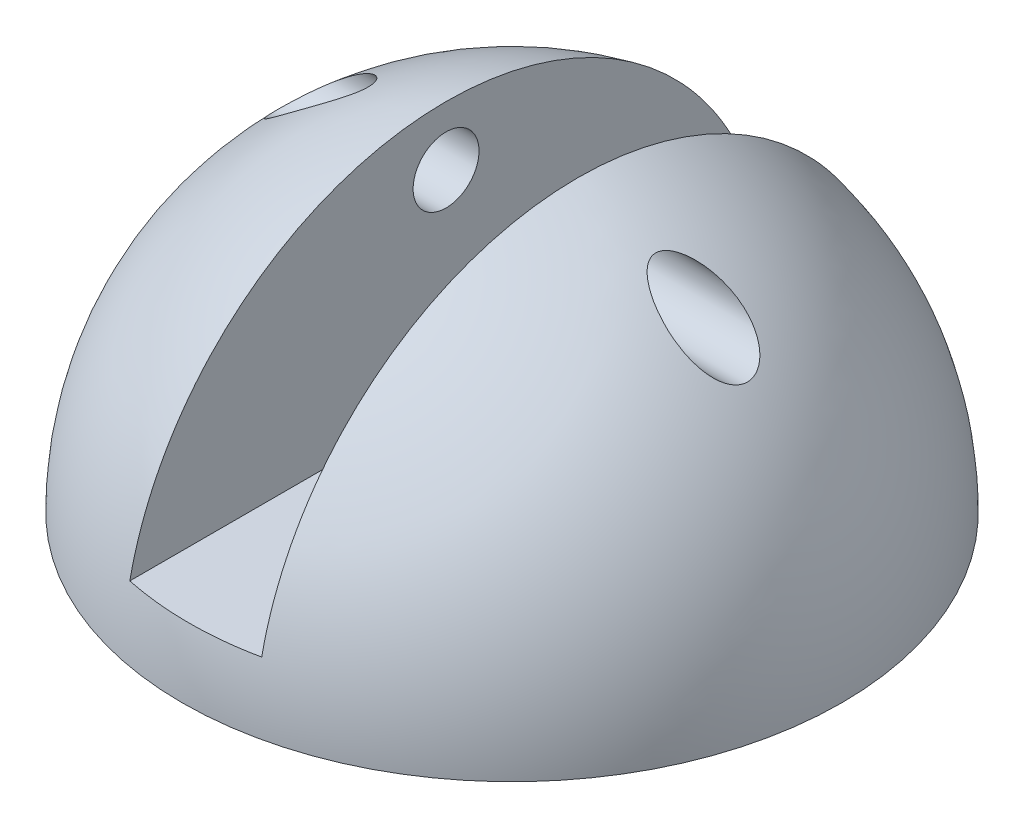
from build123d import *

# Parameters (mm, degrees)
REVOLVE1_ANGLE          = 180
SKETCH2_W               = 10
SKETCH2_H               = 40
CUT_EXTRUDE1_DEPTH      = 50
CUT_EXTRUDE2_DEPTH      = 50
CUT_EXTRUDE2_DEPTH_BACK = 50
SKETCH3_R               = 5


with BuildPart() as part:
    # Sketch1 → Revolve1 (revolve)
    with BuildSketch(Plane(origin=(0, 0, 0), x_dir=(1, 0, 0), z_dir=(0, 1, 0))):
        with BuildLine():
            Line((0, -50), (0, 50))
            ThreePointArc((0, 50), (50, 0), (0, -50))
        make_face()
    revolve(axis=Axis((0, 0, 50), (0, 0, 1)), revolution_arc=REVOLVE1_ANGLE)

    # Sketch2 → Cut-Extrude1 (cut, symmetric)
    with BuildSketch(Plane.XY):
        with Locations((5, 30)):
            Rectangle(SKETCH2_W, SKETCH2_H)
    cut_extrude1 = extrude(amount=CUT_EXTRUDE1_DEPTH, both=True, mode=Mode.SUBTRACT)

    # Mirror1: Cut-Extrude1 across plane
    add(cut_extrude1.mirror(Plane(origin=(0, 0, 0), x_dir=(0, 0, 1), z_dir=(1, 0, 0))), mode=Mode.SUBTRACT)

    # Sketch3 → Cut-Extrude2 (cut, two sides: drawn at the far end of the back side and taken through both)
    with BuildSketch(Plane(origin=(0, 0, 0), x_dir=(0, 0, -1), z_dir=(1, 0, 0)).offset(-CUT_EXTRUDE2_DEPTH_BACK)):
        with Locations((0, 40)):
            Circle(SKETCH3_R)
    extrude(amount=CUT_EXTRUDE2_DEPTH + CUT_EXTRUDE2_DEPTH_BACK, mode=Mode.SUBTRACT)


solid = part.part
